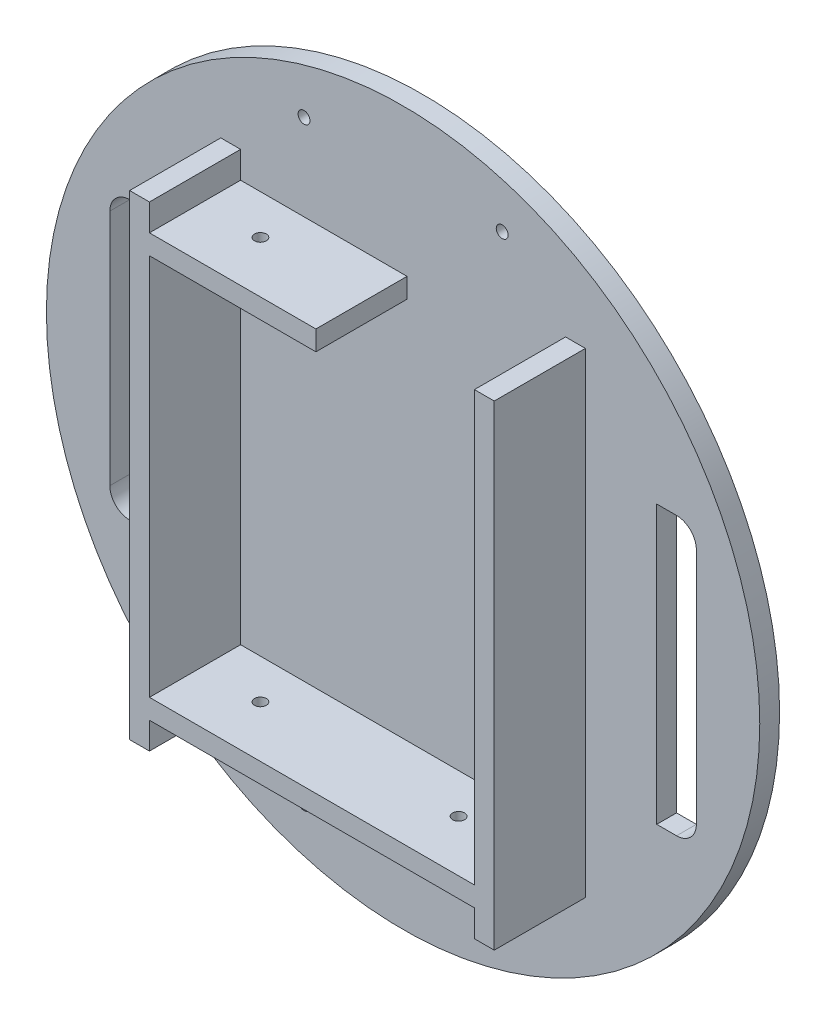
from build123d import *

# Parameters (mm, degrees)
SKETCH_1_R          = 90
EXTRUDE_1_DEPTH     = 5
CUT_EXTRUDE_1_DEPTH = 128.377392029
SKETCH_2_R          = 1.5
CUT_EXTRUDE_2_DEPTH = 128.377392029
SKETCH_4_W          = 5
SKETCH_4_H          = 120
EXTRUDE_2_DEPTH     = 23
SKETCH_5_W          = 82
SKETCH_5_H          = 5
SKETCH_5_W_2        = 42
EXTRUDE_3_DEPTH     = 23
SKETCH_6_R          = 1.5
CUT_EXTRUDE_3_DEPTH = 172.477585999


with BuildPart() as part:
    # 草圖1 → 填料-伸長1 (new body)
    with BuildSketch(Plane.XY):
        Circle(SKETCH_1_R)
    extrude(amount=EXTRUDE_1_DEPTH)

    # 草圖3 → 除料-伸長1 (cut, through all)
    with BuildSketch(Plane.XY.offset(5)):
        with BuildLine():
            ThreePointArc((-69, -35), (-72.535533906, -33.535533906), (-74, -30))
            Line((-74, -30), (-74, 30))
            ThreePointArc((-74, 30), (-72.535533906, 33.535533906), (-69, 35))
            Line((-69, 35), (-64, 35))
            Line((-64, 35), (-64, -35))
            Line((-64, -35), (-69, -35))
        make_face()
        with BuildLine():
            Line((64, 35), (64, -35))
            Line((64, -35), (69, -35))
            ThreePointArc((69, -35), (72.535533906, -33.535533906), (74, -30))
            Line((74, -30), (74, 30))
            ThreePointArc((74, 30), (72.535533906, 33.535533906), (69, 35))
            Line((69, 35), (64, 35))
        make_face()
    extrude(amount=-CUT_EXTRUDE_1_DEPTH, mode=Mode.SUBTRACT)

    # 草圖2 → 除料-伸長2 (cut, through all)
    with BuildSketch(Plane.XY.offset(5)):
        with Locations((-25, 75)):
            Circle(SKETCH_2_R)
        with Locations(Location((-25, -75, 0), (0, 0, 180))):
            Circle(SKETCH_2_R)
        with Locations(Location((25, 75, 0), (0, 0, 180))):
            Circle(SKETCH_2_R)
        with Locations((25, -75)):
            Circle(SKETCH_2_R)
    extrude(amount=-CUT_EXTRUDE_2_DEPTH, mode=Mode.SUBTRACT)

    # 草圖4 → 填料-伸長2 (add)
    with BuildSketch(Plane.XY.offset(5)):
        with Locations((-43.5, 0)):
            Rectangle(SKETCH_4_W, SKETCH_4_H)
        with Locations((43.5, 0)):
            Rectangle(SKETCH_4_W, SKETCH_4_H)
    extrude(amount=EXTRUDE_2_DEPTH)

    # 草圖5 → 填料-伸長3 (add)
    with BuildSketch(Plane.XY.offset(5)):
        with Locations((0, -50.75)):
            Rectangle(SKETCH_5_W, SKETCH_5_H)
        with Locations((-20, 50.75)):
            Rectangle(SKETCH_5_W_2, SKETCH_5_H)
    extrude(amount=EXTRUDE_3_DEPTH)

    # 草圖6 → 除料-伸長3 (cut, through all)
    with BuildSketch(Plane(origin=(0, -53.25, 0), x_dir=(-1, 0, 0), z_dir=(0, -1, 0))):
        with Locations(Location((26, -15, 0), (0, 0, 90))):
            Circle(SKETCH_6_R)
        with Locations(Location((-24, -15, 0), (0, 0, 180))):
            Circle(SKETCH_6_R)
    extrude(amount=-CUT_EXTRUDE_3_DEPTH, mode=Mode.SUBTRACT)


solid = part.part
